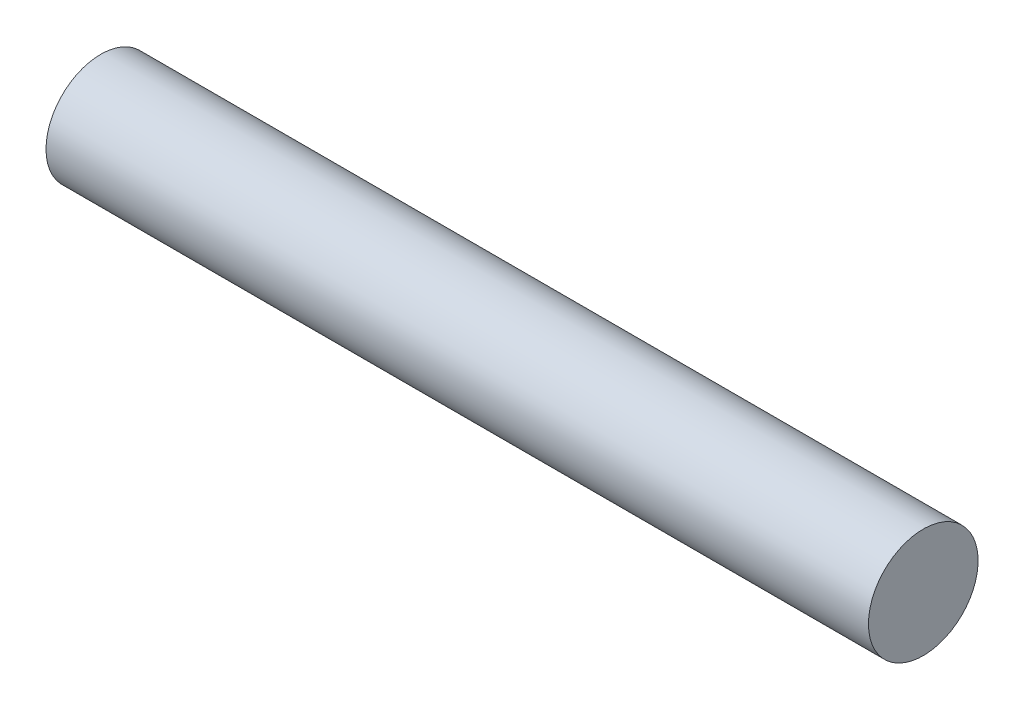
from build123d import *

# Parameters (mm, degrees)
SKETCH_1_W = 45
SKETCH_1_H = 3


with BuildPart() as part:
    # 草图1 → 旋转1 (revolve)
    with BuildSketch(Plane.XY, mode=Mode.PRIVATE) as revolve_1_sk:
        with Locations((-10.169724771, 1.5)):
            Rectangle(SKETCH_1_W, SKETCH_1_H)
    revolve(revolve_1_sk.sketch.rotate(Axis((-32.669724771, 0, 0), (1, 0, 0)), 90), axis=Axis((-32.669724771, 0, 0), (1, 0, 0)))


solid = part.part
